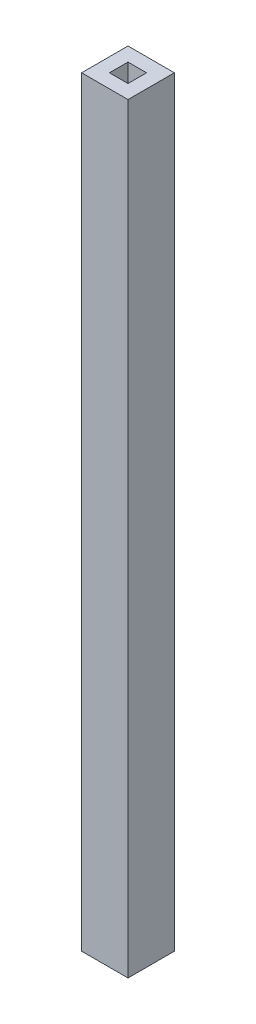
from build123d import *

# Parameters (mm, degrees)
SKETCH1_W           = 5
SKETCH1_H           = 5
SKETCH1_W_2         = 2
SKETCH1_H_2         = 2
BOSS_EXTRUDE1_DEPTH = 82


with BuildPart() as part:
    # Sketch1 → Boss-Extrude1 (new body)
    with BuildSketch(Plane(origin=(0, 0, 0), x_dir=(1, 0, 0), z_dir=(0, 1, 0))):
        Rectangle(SKETCH1_W, SKETCH1_H)
        Rectangle(SKETCH1_W_2, SKETCH1_H_2, mode=Mode.SUBTRACT)
    extrude(amount=BOSS_EXTRUDE1_DEPTH)


solid = part.part
